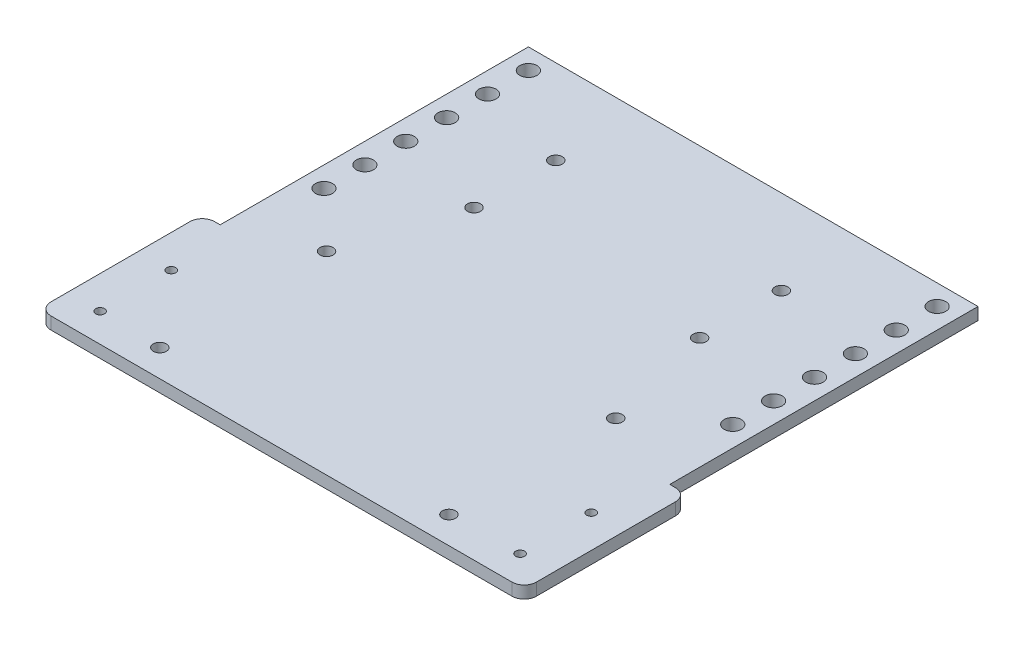
from build123d import *

# Parameters (mm, degrees)
CROQUIS1_W              = 190
CROQUIS1_H              = 115.4
SALIENTE_EXTRUIR1_DEPTH = 3
CROQUIS2_R              = 1.6
CORTAR_EXTRUIR1_DEPTH   = 5
CROQUIS4_R              = 1.1
CORTAR_EXTRUIR3_DEPTH   = 5
CROQUIS5_W              = 35.625
CROQUIS5_H              = 40
CORTAR_EXTRUIR4_DEPTH   = 5
REDONDEO1_R             = 3
REDONDEO2_R             = 3
REDONDEO3_R             = 3
REDONDEO4_R             = 3
CROQUIS7_R              = 1.6
CORTAR_EXTRUIR6_DEPTH   = 10
CROQUIS6_R              = 2.1
CORTAR_EXTRUIR7_DEPTH   = 3


with BuildPart() as part:
    # Croquis1 → Saliente-Extruir1 (new body)
    with BuildSketch(Plane(origin=(0, 0, 0), x_dir=(1, 0, 0), z_dir=(0, 1, 0))):
        Rectangle(CROQUIS1_W, CROQUIS1_H)
    extrude(amount=SALIENTE_EXTRUIR1_DEPTH)

    # Croquis2 → Cortar-Extruir1 (cut)
    with BuildSketch(Plane(origin=(0, 3, 0), x_dir=(1, 0, 0), z_dir=(0, 1, 0))):
        with Locations(Location((-36.375, -51.1, 0), (0, 0, 270))):
            Circle(CROQUIS2_R)
        with Locations(Location((-36.375, -10.3, 0), (0, 0, 270))):
            Circle(CROQUIS2_R)
        with Locations(Location((34.375, -10.3, 0), (0, 0, 270))):
            Circle(CROQUIS2_R)
        with Locations(Location((34.375, -51.1, 0), (0, 0, 270))):
            Circle(CROQUIS2_R)
    extrude(amount=-CORTAR_EXTRUIR1_DEPTH, mode=Mode.SUBTRACT)

    # Croquis4 → Cortar-Extruir3 (cut)
    with BuildSketch(Plane(origin=(0, 3, 0), x_dir=(1, 0, 0), z_dir=(0, 1, 0))):
        with Locations(Location((-51.375, -50.7, 0), (0, 0, 270))):
            Circle(CROQUIS4_R)
        with Locations(Location((-51.375, -33.3, 0), (0, 0, 270))):
            Circle(CROQUIS4_R)
        with Locations(Location((51.375, -33.3, 0), (0, 0, 270))):
            Circle(CROQUIS4_R)
        with Locations(Location((51.375, -50.7, 0), (0, 0, 270))):
            Circle(CROQUIS4_R)
    extrude(amount=-CORTAR_EXTRUIR3_DEPTH, mode=Mode.SUBTRACT)

    # Croquis5 → Cortar-Extruir4 (cut)
    with BuildSketch(Plane(origin=(0, 3, 0), x_dir=(1, 0, 0), z_dir=(0, 1, 0))):
        with Locations((-77.1875, -37.7)):
            Rectangle(CROQUIS5_W, CROQUIS5_H)
        Polygon((-95, 57.7), (-95, -17.7), (-59.375, -17.7), (-55, -17.7), (-55, 57.7), align=None)
        with Locations((77.1875, -37.7)):
            Rectangle(CROQUIS5_W, CROQUIS5_H)
        Polygon((55, -17.7), (59.375, -17.7), (95, -17.7), (95, 57.7), (55, 57.7), align=None)
    extrude(amount=-CORTAR_EXTRUIR4_DEPTH, mode=Mode.SUBTRACT)

    # Redondeo1
    redondeo1_edges = [part.edges().sort_by_distance(p)[0] for p in [
        (59.375, 1.5, 17.7),
    ]]
    fillet(redondeo1_edges, radius=REDONDEO1_R)

    # Redondeo2
    redondeo2_edges = [part.edges().sort_by_distance(p)[0] for p in [
        (-59.375, 1.5, 17.7),
    ]]
    fillet(redondeo2_edges, radius=REDONDEO2_R)

    # Redondeo3
    redondeo3_edges = [part.edges().sort_by_distance(p)[0] for p in [
        (-59.375, 1.5, 57.7),
    ]]
    fillet(redondeo3_edges, radius=REDONDEO3_R)

    # Redondeo4
    redondeo4_edges = [part.edges().sort_by_distance(p)[0] for p in [
        (59.375, 1.5, 57.7),
    ]]
    fillet(redondeo4_edges, radius=REDONDEO4_R)

    # Croquis7 → Cortar-Extruir6 (cut)
    with BuildSketch(Plane(origin=(0, 3, 0), x_dir=(1, 0, 0), z_dir=(0, 1, 0))):
        with Locations(Location((27.6, 17, 0), (0, 0, 270))):
            Circle(CROQUIS7_R)
        with Locations(Location((-27.6, 17, 0), (0, 0, 270))):
            Circle(CROQUIS7_R)
        with Locations(Location((-27.6, 37, 0), (0, 0, 270))):
            Circle(CROQUIS7_R)
        with Locations(Location((27.6, 37, 0), (0, 0, 270))):
            Circle(CROQUIS7_R)
    extrude(amount=-CORTAR_EXTRUIR6_DEPTH, mode=Mode.SUBTRACT)

    # Croquis6 → Cortar-Extruir7 (cut)
    with BuildSketch(Plane(origin=(0, 3, 0), x_dir=(1, 0, 0), z_dir=(0, 1, 0))):
        with Locations(Location((-50, 2.7, 0), (0, 0, 270))):
            Circle(CROQUIS6_R)
        with Locations(Location((-50, 12.7, 0), (0, 0, 270))):
            Circle(CROQUIS6_R)
        with Locations(Location((-50, 22.7, 0), (0, 0, 270))):
            Circle(CROQUIS6_R)
        with Locations(Location((-50, 32.7, 0), (0, 0, 270))):
            Circle(CROQUIS6_R)
        with Locations(Location((-50, 42.7, 0), (0, 0, 270))):
            Circle(CROQUIS6_R)
        with Locations(Location((-50, 52.7, 0), (0, 0, 270))):
            Circle(CROQUIS6_R)
        with Locations(Location((50, 2.7, 0), (0, 0, 270))):
            Circle(CROQUIS6_R)
        with Locations(Location((50, 12.7, 0), (0, 0, 270))):
            Circle(CROQUIS6_R)
        with Locations(Location((50, 22.7, 0), (0, 0, 270))):
            Circle(CROQUIS6_R)
        with Locations(Location((50, 32.7, 0), (0, 0, 270))):
            Circle(CROQUIS6_R)
        with Locations(Location((50, 42.7, 0), (0, 0, 270))):
            Circle(CROQUIS6_R)
        with Locations(Location((50, 52.7, 0), (0, 0, 270))):
            Circle(CROQUIS6_R)
    extrude(amount=-CORTAR_EXTRUIR7_DEPTH, mode=Mode.SUBTRACT)


solid = part.part
